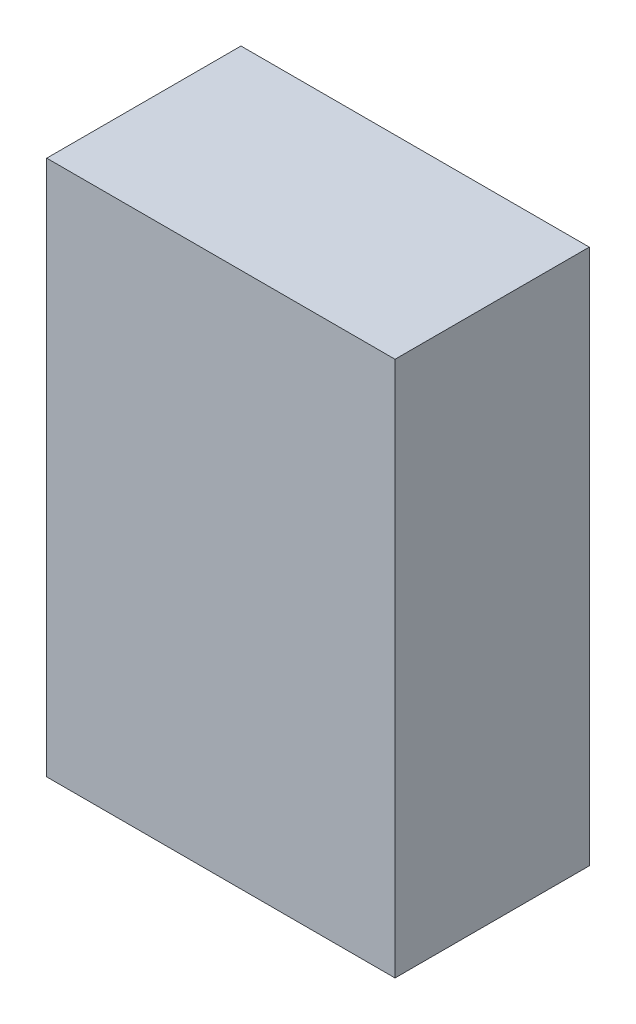
from build123d import *

# Parameters (mm, degrees)
SKETCH1_W      = 660.4
SKETCH1_H      = 368.3
EXTRUDE1_DEPTH = 1016


with BuildPart() as part:
    # Sketch1 → Extrude1 (new body)
    with BuildSketch(Plane(origin=(0, 0, 0), x_dir=(1, 0, 0), z_dir=(0, 1, 0))):
        with Locations((330.2, 184.15)):
            Rectangle(SKETCH1_W, SKETCH1_H)
    extrude(amount=EXTRUDE1_DEPTH)


solid = part.part
